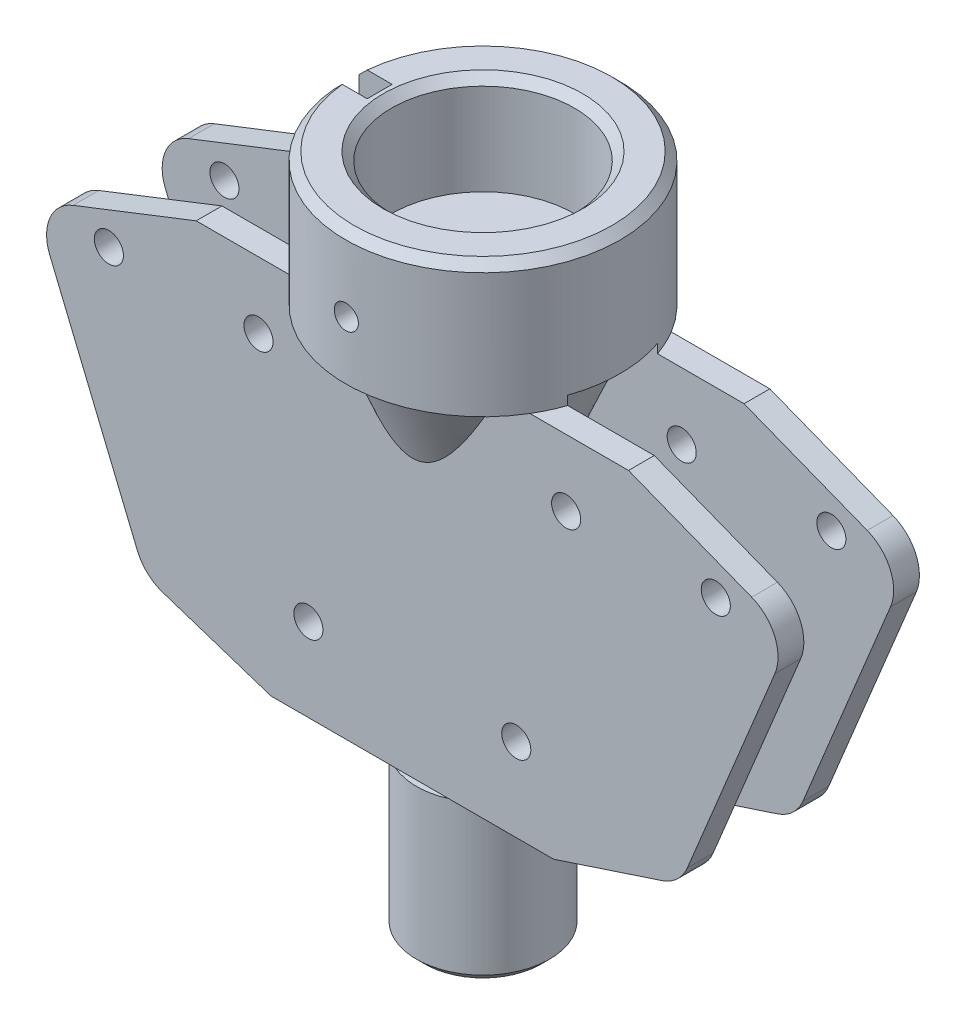
from build123d import *

# Parameters (mm, degrees)
BASE_EXTRUSION_DEPTH    = 17
CONG_1_R                = 5
CONG_2_R                = 5
CONG_3_R                = 5
CONG_4_R                = 5
ESQUISSE5_R             = 16.5
BOSS_EXTRU_1_DEPTH      = 16
ENL_V_START             = -43.991208
ESQUISSE9_W             = 10.8
ESQUISSE9_H             = 51.405339809
ENL_V_MAT_EXTRU_2_DEPTH = 87.982416
ESQUISSE15_R            = 6
BOSS_EXTRU_2_DEPTH      = 26
ESQUISSE16_R            = 8
BOSS_EXTRU_3_DEPTH      = 19
CHANFREIN1_SIZE         = 1
ESQUISSE17_R            = 1.75
ENL_V_MAT_EXTRU_3_DEPTH = 80.254188527
ESQUISSE18_R            = 11
ENL_V_MAT_EXTRU_4_DEPTH = 12
ESQUISSE19_R            = 4.5
ENL_V_MAT_EXTRU_5_DEPTH = 82
CHANFREIN2_SIZE         = 1
CHANFREIN3_SIZE         = 1
ESQUISSE23_W            = 1.45
ESQUISSE23_H            = 25
EXTRUSION1_START        = -10
EXTRUSION1_DEPTH        = 10


with BuildPart() as part:
    # Esquisse1 → Base-Extrusion (new body)
    with BuildSketch(Plane.XY):
        Polygon((-17, 0), (17, 0), (32.198684154, 5), (45.557198765, 37.350426386), (26, 45), (-26, 45), (-45.557198765, 37.350426386), (-32.198684154, 5), align=None)
    extrude(amount=BASE_EXTRUSION_DEPTH)

    # Congé1
    cong_1_edges = [part.edges().sort_by_distance(p)[0] for p in [
        (45.557198765, 37.350426386, 8.5),
    ]]
    fillet(cong_1_edges, radius=CONG_1_R)

    # Congé2
    cong_2_edges = [part.edges().sort_by_distance(p)[0] for p in [
        (-45.557198765, 37.350426386, 8.5),
    ]]
    fillet(cong_2_edges, radius=CONG_2_R)

    # Congé3
    cong_3_edges = [part.edges().sort_by_distance(p)[0] for p in [
        (-32.198684154, 5, 8.5),
    ]]
    fillet(cong_3_edges, radius=CONG_3_R)

    # Congé4
    cong_4_edges = [part.edges().sort_by_distance(p)[0] for p in [
        (32.198684154, 5, 8.5),
    ]]
    fillet(cong_4_edges, radius=CONG_4_R)

    # Esquisse5 → Boss.-Extru.1 (add)
    with BuildSketch(Plane(origin=(0, 45, 0), x_dir=(-1, 0, 0), z_dir=(0, 1, 0))):
        with Locations(Location((0, 8.5, 0), (0, 0, 211.007583007))):
            Circle(ESQUISSE5_R)
    extrude(amount=BOSS_EXTRU_1_DEPTH)

    # Esquisse9 → Enlèv. mat.-Extru.2 (cut)
    with BuildSketch(Plane(origin=(0, 0, 0), x_dir=(0, 0, -1), z_dir=(1, 0, 0)).offset(ENL_V_START)):
        with Locations((-8.5, 20.378761833)):
            Rectangle(ESQUISSE9_W, ESQUISSE9_H)
    extrude(amount=ENL_V_MAT_EXTRU_2_DEPTH, mode=Mode.SUBTRACT)

    # Esquisse14 → Boss.-Révol.1 (revolve)
    with BuildSketch(Plane(origin=(0, 0, 0), x_dir=(0, 0, -1), z_dir=(1, 0, 0))):
        Polygon((-8.5, 45.740204338), (-22.261709351, 45.740204338), (-13.428527568, 24.827476443), (-8.5, 24.827476443), align=None)
    revolve(axis=Axis((0, 54.838113355, 8.5), (0, -1, 0)))

    # Esquisse15 → Boss.-Extru.2 (add)
    with BuildSketch(Plane.XZ.offset(-24.827476443)):
        with Locations(Location((0, 8.5, 0), (0, 0, 64.158067237))):
            Circle(ESQUISSE15_R)
    extrude(amount=BOSS_EXTRU_2_DEPTH)

    # Esquisse16 → Boss.-Extru.3 (add)
    with BuildSketch(Plane.XZ.offset(1.172523557)):
        with Locations(Location((0, 8.5, 0), (0, 0, 270))):
            Circle(ESQUISSE16_R)
    extrude(amount=BOSS_EXTRU_3_DEPTH)

    # Chanfrein1
    chanfrein1_edges = [part.edges().sort_by_distance(p)[0] for p in [
        (0, -20.172523557, 16.5),
    ]]
    chamfer(chanfrein1_edges, length=CHANFREIN1_SIZE)

    # Esquisse17 → Enlèv. mat.-Extru.3 (cut, through all)
    with BuildSketch(Plane.XY.offset(17)):
        with Locations((-36.5, 37)):
            Circle(ESQUISSE17_R)
        with Locations((-18.5, 37)):
            Circle(ESQUISSE17_R)
        with Locations((-12.5, 10)):
            Circle(ESQUISSE17_R)
        with Locations((12.5, 10)):
            Circle(ESQUISSE17_R)
        with Locations((18.5, 37)):
            Circle(ESQUISSE17_R)
        with Locations((36.5, 37)):
            Circle(ESQUISSE17_R)
    extrude(amount=-ENL_V_MAT_EXTRU_3_DEPTH, mode=Mode.SUBTRACT)

    # Esquisse18 → Enlèv. mat.-Extru.4 (cut)
    with BuildSketch(Plane(origin=(0, 61, 0), x_dir=(-1, 0, 0), z_dir=(0, 1, 0))):
        with Locations(Location((0, 8.5, 0), (0, 0, 90))):
            Circle(ESQUISSE18_R)
    extrude(amount=-ENL_V_MAT_EXTRU_4_DEPTH, mode=Mode.SUBTRACT)

    # Esquisse19 → Enlèv. mat.-Extru.5 (cut)
    with BuildSketch(Plane(origin=(0, 49, 0), x_dir=(-1, 0, 0), z_dir=(0, 1, 0))):
        with Locations(Location((0, 8.5, 0), (0, 0, 90))):
            Circle(ESQUISSE19_R)
    extrude(amount=-ENL_V_MAT_EXTRU_5_DEPTH, mode=Mode.SUBTRACT)

    # Chanfrein2
    chanfrein2_edges = [part.edges().sort_by_distance(p)[0] for p in [
        (0, 61, -2.5),
    ]]
    chamfer(chanfrein2_edges, length=CHANFREIN2_SIZE)

    # Chanfrein3
    chanfrein3_edges = [part.edges().sort_by_distance(p)[0] for p in [
        (-14.142135624, 61, 17),
    ]]
    chamfer(chanfrein3_edges, length=CHANFREIN3_SIZE)

    # Esquisse23 → Trou taraudé M3.5x0.61 (revolve, cut)
    with BuildSketch(Plane(origin=(0, 52, 0), x_dir=(0, 1, 0), z_dir=(1, 0, 0))):
        with Locations((0.725, 12.5)):
            Rectangle(ESQUISSE23_W, ESQUISSE23_H)
    revolve(axis=Axis((0, 52, -6.35), (0, 0, 1)), mode=Mode.SUBTRACT)

    # Esquisse24 → Extrusion1 (cut)
    with BuildSketch(Plane(origin=(0, 61, 0), x_dir=(-1, 0, 0), z_dir=(0, 1, 0)).offset(EXTRUSION1_START)):
        with BuildLine():
            Line((16.431676725, 10), (12.431676725, 10))
            Line((12.431676725, 10), (12.431676725, 7))
            Line((12.431676725, 7), (16.431676725, 7))
            ThreePointArc((16.431676725, 7), (16.5, 8.5), (16.431676725, 10))
        make_face()
    extrude(amount=EXTRUSION1_DEPTH, mode=Mode.SUBTRACT)


solid = part.part
